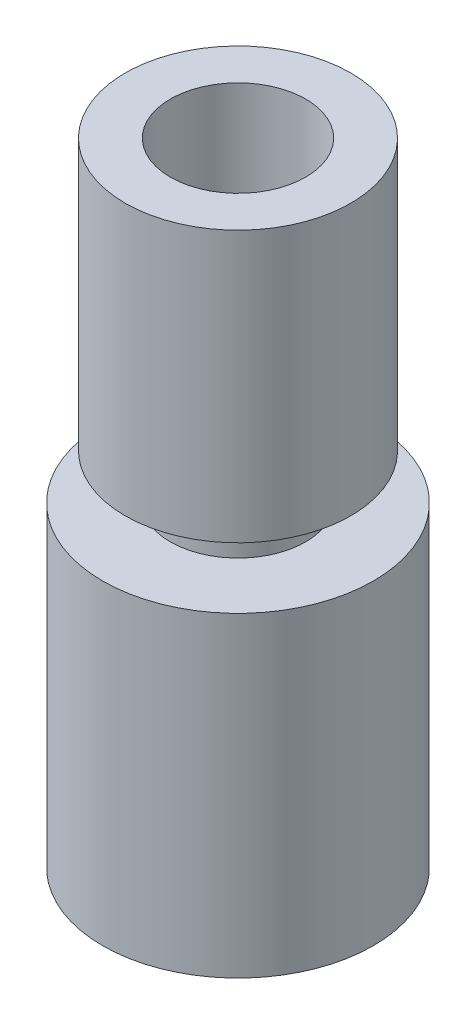
from build123d import *


with BuildPart() as part:
    # Croquis1 → Revolución1 (revolve)
    with BuildSketch(Plane.XY, mode=Mode.PRIVATE) as revoluci_n1_sk:
        Polygon((-3, 0), (-1.5, 0), (-1.5, 3), (0, 3), (0, 11), (-1.5, 11), (-1.5, 14), (-2.5, 14), (-2.5, 8), (-1.5, 8), (-1.5, 7), (-3, 7), align=None)
    revolve(revoluci_n1_sk.sketch.rotate(Axis((0, 11, 0), (0, -1, 0)), 270), axis=Axis((0, 11, 0), (0, -1, 0)))


solid = part.part
